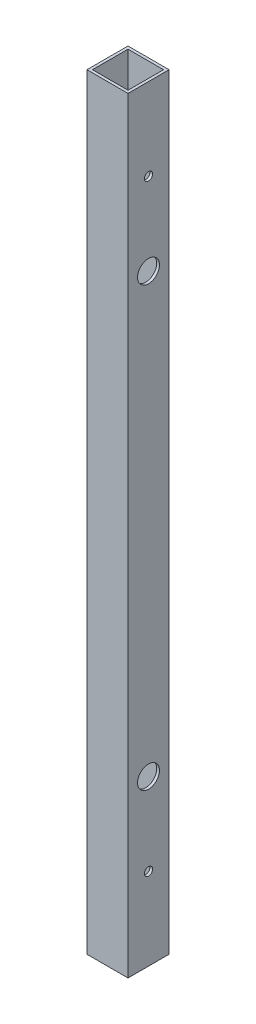
from build123d import *

# Parameters (mm, degrees)
SKETCH_1_W          = 15
SKETCH_1_H          = 15
SKETCH_1_W_2        = 13
SKETCH_1_H_2        = 13
EXTRUDE_1_DEPTH     = 280
SKETCH_2_R          = 1.5
CUT_EXTRUDE_1_DEPTH = 260
SKETCH_3_R          = 4
CUT_EXTRUDE_2_DEPTH = 2
SKETCH_4_R          = 1.5
CUT_EXTRUDE_3_DEPTH = 281.501782526
SKETCH_5_R          = 4
CUT_EXTRUDE_4_DEPTH = 2


with BuildPart() as part:
    # 草图1 → 凸台-拉伸1 (new body)
    with BuildSketch(Plane(origin=(0, 0, 0), x_dir=(1, 0, 0), z_dir=(0, 1, 0))):
        Rectangle(SKETCH_1_W, SKETCH_1_H)
        Rectangle(SKETCH_1_W_2, SKETCH_1_H_2, mode=Mode.SUBTRACT)
    extrude(amount=EXTRUDE_1_DEPTH)

    # 草图2 → 切除-拉伸1 (cut)
    with BuildSketch(Plane.ZY.offset(7.5)):
        with Locations((0, 220)):
            Circle(SKETCH_2_R)
        with Locations((0, 60)):
            Circle(SKETCH_2_R)
    extrude(amount=-CUT_EXTRUDE_1_DEPTH, mode=Mode.SUBTRACT)

    # 草图3 → 切除-拉伸2 (cut)
    with BuildSketch(Plane(origin=(7.5, 0, 0), x_dir=(0, 0, -1), z_dir=(1, 0, 0))):
        with Locations((0, 60)):
            Circle(SKETCH_3_R)
        with Locations((0, 220)):
            Circle(SKETCH_3_R)
    extrude(amount=-CUT_EXTRUDE_2_DEPTH, mode=Mode.SUBTRACT)

    # 草图4 → 切除-拉伸3 (cut, through all)
    with BuildSketch(Plane(origin=(7.5, 0, 0), x_dir=(0, 0, -1), z_dir=(1, 0, 0))):
        with Locations((0, 250)):
            Circle(SKETCH_4_R)
        with Locations(Location((0, 30, 0), (0, 0, 180))):
            Circle(SKETCH_4_R)
    extrude(amount=-CUT_EXTRUDE_3_DEPTH, mode=Mode.SUBTRACT)

    # 草图5 → 切除-拉伸4 (cut)
    with BuildSketch(Plane.ZY.offset(7.5)):
        with Locations((0, 250)):
            Circle(SKETCH_5_R)
        with Locations((0, 30)):
            Circle(SKETCH_5_R)
    extrude(amount=-CUT_EXTRUDE_4_DEPTH, mode=Mode.SUBTRACT)


solid = part.part
